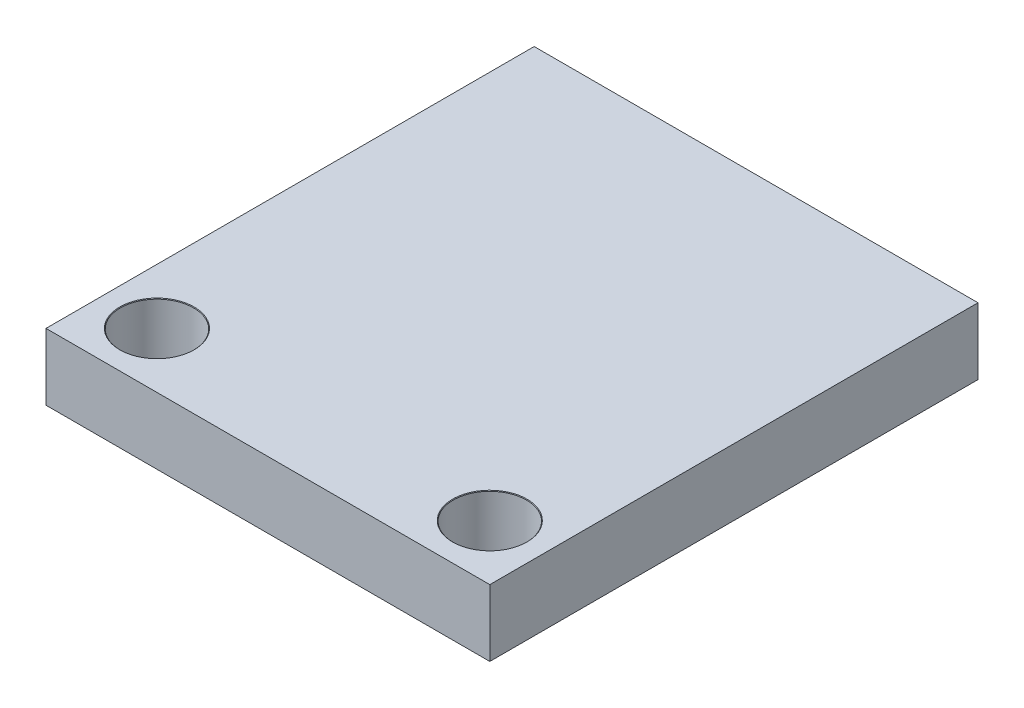
from build123d import *

# Parameters (mm, degrees)
SKETCH1_W                            = 20
SKETCH1_H                            = 22
BOSS_EXTRUDE1_DEPTH                  = 3
F_3_3_3_3_DIAMETER_HOLE1_D           = 3.3
F_3_3_3_3_DIAMETER_HOLE1_CSINK_D     = 3.35
F_3_3_3_3_DIAMETER_HOLE1_CSINK_ANGLE = 90


with BuildPart() as part:
    # Sketch1 → Boss-Extrude1 (new body)
    with BuildSketch(Plane(origin=(0, 0, 0), x_dir=(1, 0, 0), z_dir=(0, 1, 0))):
        Rectangle(SKETCH1_W, SKETCH1_H)
    extrude(amount=BOSS_EXTRUDE1_DEPTH)

    # Ø3.3 (3.3) Diameter Hole1 (through all)
    with Locations(Plane(origin=(0, 3, 0), x_dir=(1, 0, 0), z_dir=(0, 1, 0))):
        with Locations((7.5, -8.5), (-7.5, -8.5)):
            CounterSinkHole(F_3_3_3_3_DIAMETER_HOLE1_D / 2, F_3_3_3_3_DIAMETER_HOLE1_CSINK_D / 2, counter_sink_angle=F_3_3_3_3_DIAMETER_HOLE1_CSINK_ANGLE)


solid = part.part
